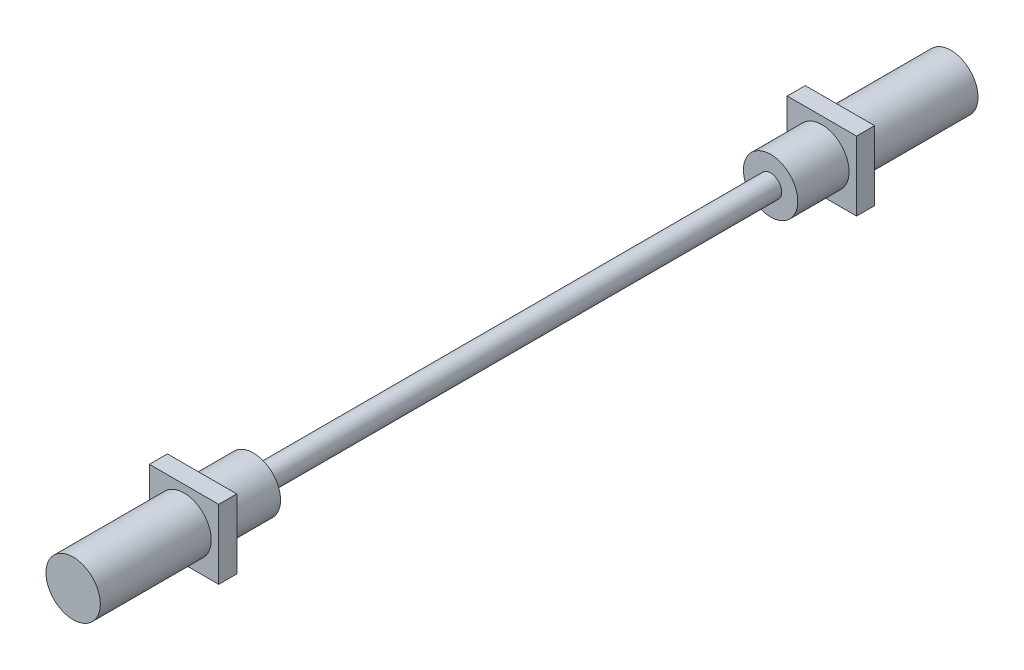
from build123d import *

# Parameters (mm, degrees)
SKETCH1_R           = 1.016
BOSS_EXTRUDE1_DEPTH = 47.371
SKETCH2_R           = 2.4892
BOSS_EXTRUDE2_DEPTH = 4.699
SKETCH3_W           = 6.35
SKETCH3_H           = 6.35
BOSS_EXTRUDE3_DEPTH = 1.651
SKETCH4_R           = 2.4892
BOSS_EXTRUDE4_DEPTH = 10.16
BOSS_EXTRUDE5_START = 4.699
SKETCH5_R           = 2.4892
BOSS_EXTRUDE5_DEPTH = 4.699
SKETCH6_W           = 6.35
SKETCH6_H           = 6.35
BOSS_EXTRUDE6_DEPTH = 1.651
BOSS_EXTRUDE7_START = 10.16
SKETCH7_R           = 2.4892
BOSS_EXTRUDE7_DEPTH = 10.16


with BuildPart() as part:
    # Sketch1 → Boss-Extrude1 (new body)
    with BuildSketch(Plane.XY):
        Circle(SKETCH1_R)
    extrude(amount=BOSS_EXTRUDE1_DEPTH)

    # Sketch2 → Boss-Extrude2 (add)
    with BuildSketch(Plane(origin=(0, 0, 0), x_dir=(-1, 0, 0), z_dir=(0, 0, -1))):
        Circle(SKETCH2_R)
    extrude(amount=BOSS_EXTRUDE2_DEPTH)

    # Sketch3 → Boss-Extrude3 (add)
    with BuildSketch(Plane(origin=(0, 0, -4.699), x_dir=(-1, 0, 0), z_dir=(0, 0, -1))):
        Rectangle(SKETCH3_W, SKETCH3_H)
    extrude(amount=BOSS_EXTRUDE3_DEPTH)

    # Sketch4 → Boss-Extrude4 (add)
    with BuildSketch(Plane(origin=(0, 0, -6.35), x_dir=(-1, 0, 0), z_dir=(0, 0, -1))):
        Circle(SKETCH4_R)
    extrude(amount=BOSS_EXTRUDE4_DEPTH)

    # Sketch5 → Boss-Extrude5 (add)
    with BuildSketch(Plane.XY.offset(47.371).offset(BOSS_EXTRUDE5_START)):
        with Locations(Location((0, 0, 0), (0, 0, 180))):
            Circle(SKETCH5_R)
    extrude(amount=-BOSS_EXTRUDE5_DEPTH)

    # Sketch6 → Boss-Extrude6 (add)
    with BuildSketch(Plane.XY.offset(52.07)):
        Rectangle(SKETCH6_W, SKETCH6_H)
    extrude(amount=BOSS_EXTRUDE6_DEPTH)

    # Sketch7 → Boss-Extrude7 (add)
    with BuildSketch(Plane.XY.offset(53.721).offset(BOSS_EXTRUDE7_START)):
        with Locations(Location((0, 0, 0), (0, 0, 180))):
            Circle(SKETCH7_R)
    extrude(amount=-BOSS_EXTRUDE7_DEPTH)


solid = part.part
